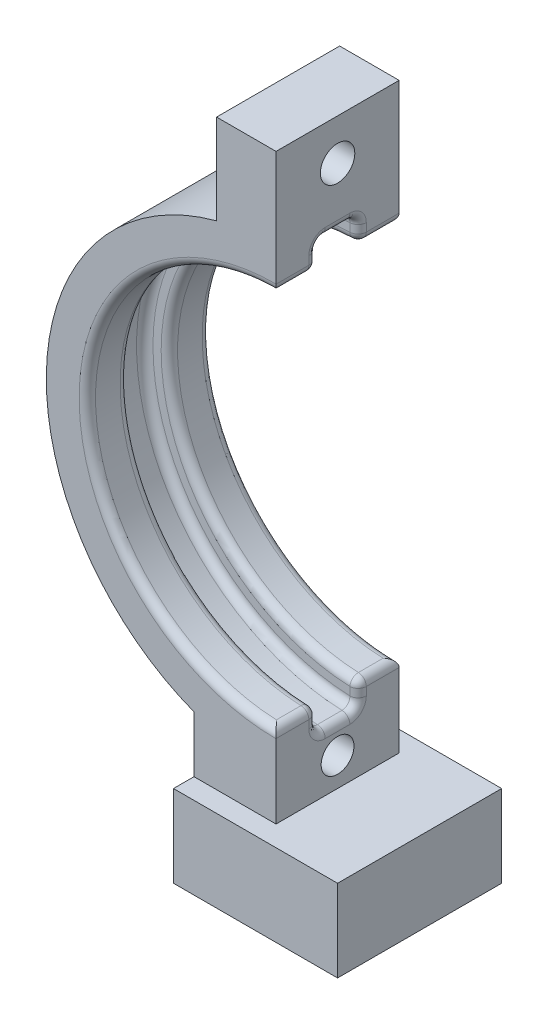
from build123d import *

# Parameters (mm, degrees)
SKETCH1_W           = 20
SKETCH1_H           = 40
BOSS_EXTRUDE1_DEPTH = 15
SKETCH2_W           = 20
SKETCH2_H           = 20
BOSS_EXTRUDE2_DEPTH = 10
BOSS_EXTRUDE3_DEPTH = 5
BOSS_EXTRUDE4_DEPTH = 5
BOSS_EXTRUDE5_DEPTH = 5
BOSS_EXTRUDE6_DEPTH = 15
SKETCH7_R           = 2.1
SKETCH7_R_2         = 2
CUT_EXTRUDE1_DEPTH  = 108.703296143
FILLET5_R           = 1
SKETCH9_W           = 40
SKETCH9_H           = 15
CUT_EXTRUDE2_DEPTH  = 20


with BuildPart() as part:
    # Sketch1 → Boss-Extrude1 (new body)
    with BuildSketch(Plane(origin=(0, 0, 0), x_dir=(1, 0, 0), z_dir=(0, 1, 0))):
        with Locations((10, -20)):
            Rectangle(SKETCH1_W, SKETCH1_H)
    extrude(amount=BOSS_EXTRUDE1_DEPTH)

    # Sketch2 → Boss-Extrude2 (add)
    with BuildSketch(Plane(origin=(0, 15, 0), x_dir=(1, 0, 0), z_dir=(0, 1, 0))):
        with Locations((10, -20)):
            Rectangle(SKETCH2_W, SKETCH2_H)
    extrude(amount=BOSS_EXTRUDE2_DEPTH)

    # Sketch3 → Boss-Extrude3 (add)
    with BuildSketch(Plane.XY.offset(27.5)):
        with BuildLine():
            Line((10, 35), (10, 25))
            Line((10, 25), (0, 25))
            Line((0, 25), (0, 31.846606339))
            ThreePointArc((0, 31.846606339), (-17.534478591, 63.08453427), (10, 86))
            Line((10, 86), (10, 81))
            ThreePointArc((10, 81), (-13, 58), (10, 35))
        make_face()
    extrude(amount=-BOSS_EXTRUDE3_DEPTH)

    # Sketch4 → Boss-Extrude4 (add)
    with BuildSketch(Plane(origin=(0, 0, 22.5), x_dir=(-1, 0, 0), z_dir=(0, 0, -1))):
        with BuildLine():
            Line((-10, 86), (-10, 84))
            ThreePointArc((-10, 84), (16, 58), (-10, 32))
            Line((-10, 32), (-10, 30))
            Line((-10, 30), (-10, 25))
            Line((-10, 25), (0, 25))
            Line((0, 25), (0, 31.846606339))
            ThreePointArc((0, 31.846606339), (17.534478591, 63.08453427), (-10, 86))
        make_face()
    extrude(amount=BOSS_EXTRUDE4_DEPTH)

    # Sketch5 → Boss-Extrude5 (add)
    with BuildSketch(Plane(origin=(0, 0, 17.5), x_dir=(-1, 0, 0), z_dir=(0, 0, -1))):
        with BuildLine():
            Line((-10, 86), (-10, 81))
            ThreePointArc((-10, 81), (13, 58), (-10, 35))
            Line((-10, 35), (-10, 30))
            Line((-10, 30), (-10, 25))
            Line((-10, 25), (0, 25))
            Line((0, 25), (0, 31.846606339))
            ThreePointArc((0, 31.846606339), (17.534478591, 63.08453427), (-10, 86))
        make_face()
    extrude(amount=BOSS_EXTRUDE5_DEPTH)

    # Sketch6 → Boss-Extrude6 (add)
    with BuildSketch(Plane.XY.offset(27.5)):
        with BuildLine():
            Line((10, 86), (10, 96))
            Line((10, 96), (2.753066737, 96))
            Line((2.753066737, 96), (2.753066737, 85.045923136))
            ThreePointArc((2.753066737, 85.045923136), (6.345266618, 85.760456118), (10, 86))
        make_face()
    extrude(amount=-BOSS_EXTRUDE6_DEPTH)

    # Sketch7 → Cut-Extrude1 (cut, through all)
    with BuildSketch(Plane(origin=(10, 0, 0), x_dir=(0, 0, -1), z_dir=(1, 0, 0))):
        with Locations((-20, 91)):
            Circle(SKETCH7_R)
        with Locations((-20, 28.5)):
            Circle(SKETCH7_R_2)
    extrude(amount=-CUT_EXTRUDE1_DEPTH, mode=Mode.SUBTRACT)

    # Fillet5
    fillet5_edges = [part.edges().sort_by_distance(p)[0] for p in [
        (10, 82.5, 22.5),
        (-13, 58, 22.5),
        (10, 81, 25),
        (10, 35, 25),
        (-13, 58, 27.5),
        (10, 33.5, 22.5),
        (-16, 58, 22.5),
        (10, 84, 20),
        (10, 32, 20),
        (-16, 58, 17.5),
        (10, 82.5, 17.5),
        (-13, 58, 17.5),
        (10, 81, 15),
        (10, 33.5, 17.5),
        (10, 35, 15),
        (-13, 58, 12.5),
    ]]
    fillet(fillet5_edges, radius=FILLET5_R)

    # Sketch9 → Cut-Extrude2 (cut)
    with BuildSketch(Plane(origin=(20, 0, 0), x_dir=(0, 0, -1), z_dir=(1, 0, 0))):
        with Locations((-20, 7.5)):
            Rectangle(SKETCH9_W, SKETCH9_H)
    extrude(amount=-CUT_EXTRUDE2_DEPTH, mode=Mode.SUBTRACT)


solid = part.part
